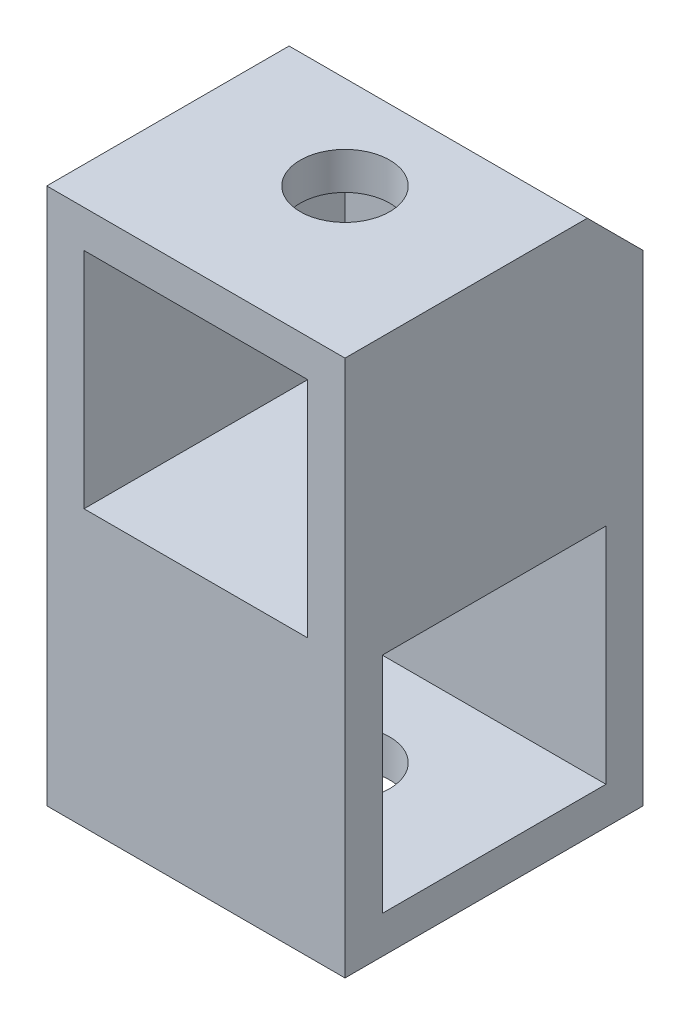
from build123d import *

# Parameters (mm, degrees)
SKETCH2_W               = 40
SKETCH2_H               = 72
BOSS_EXTRUDE1_DEPTH     = 20
SKETCH3_W               = 30
SKETCH3_H               = 30
CUT_EXTRUDE1_DEPTH      = 35
CUT_EXTRUDE2_DEPTH      = 46.782092569
CUT_EXTRUDE2_DEPTH_BACK = 46.782092569
SKETCH4_W               = 30
SKETCH4_H               = 30
CHAMFER1_SIZE           = 7.5
CUT_EXTRUDE3_DEPTH      = 46.782092569
CUT_EXTRUDE3_DEPTH_BACK = 46.782092569
SKETCH5_R               = 6
SKETCH6_R               = 6
SKETCH6_R_2             = 2.5
BOSS_EXTRUDE2_DEPTH     = 1


with BuildPart() as part:
    # Sketch2 → Boss-Extrude1 (new, symmetric)
    with BuildSketch(Plane.XY):
        Rectangle(SKETCH2_W, SKETCH2_H)
    extrude(amount=BOSS_EXTRUDE1_DEPTH, both=True)

    # Sketch3 → Cut-Extrude1 (cut)
    with BuildSketch(Plane.XY.offset(20)):
        with Locations((0, 16)):
            Rectangle(SKETCH3_W, SKETCH3_H)
    extrude(amount=-CUT_EXTRUDE1_DEPTH, mode=Mode.SUBTRACT)

    # Sketch4 → Cut-Extrude2 (cut, two sides: drawn at the far end of the back side and taken through both)
    with BuildSketch(Plane(origin=(0, 0, 0), x_dir=(0, 0, -1), z_dir=(1, 0, 0)).offset(-CUT_EXTRUDE2_DEPTH_BACK)):
        with Locations((0, -16)):
            Rectangle(SKETCH4_W, SKETCH4_H)
    extrude(amount=CUT_EXTRUDE2_DEPTH + CUT_EXTRUDE2_DEPTH_BACK, mode=Mode.SUBTRACT)

    # Chamfer1
    chamfer1_edges = [part.edges().sort_by_distance(p)[0] for p in [
        (0, 36, -20),
    ]]
    chamfer(chamfer1_edges, length=CHAMFER1_SIZE)

    # Sketch5 → Cut-Extrude3 (cut, two sides: drawn at the far end of the back side and taken through both)
    with BuildSketch(Plane(origin=(0, 0, 0), x_dir=(1, 0, 0), z_dir=(0, 1, 0)).offset(-CUT_EXTRUDE3_DEPTH_BACK)):
        with Locations(Location((0, 0, 0), (0, 0, 270))):
            Circle(SKETCH5_R)
    extrude(amount=CUT_EXTRUDE3_DEPTH + CUT_EXTRUDE3_DEPTH_BACK, mode=Mode.SUBTRACT)

    # Sketch6 → Boss-Extrude2 (add, symmetric)
    with BuildSketch(Plane(origin=(0, 0, 0), x_dir=(1, 0, 0), z_dir=(0, 1, 0))):
        with Locations(Location((0, 0, 0), (0, 0, 270))):
            Circle(SKETCH6_R)
        with Locations(Location((0, 0, 0), (0, 0, 270))):
            Circle(SKETCH6_R_2, mode=Mode.SUBTRACT)
    extrude(amount=BOSS_EXTRUDE2_DEPTH, both=True)


solid = part.part
